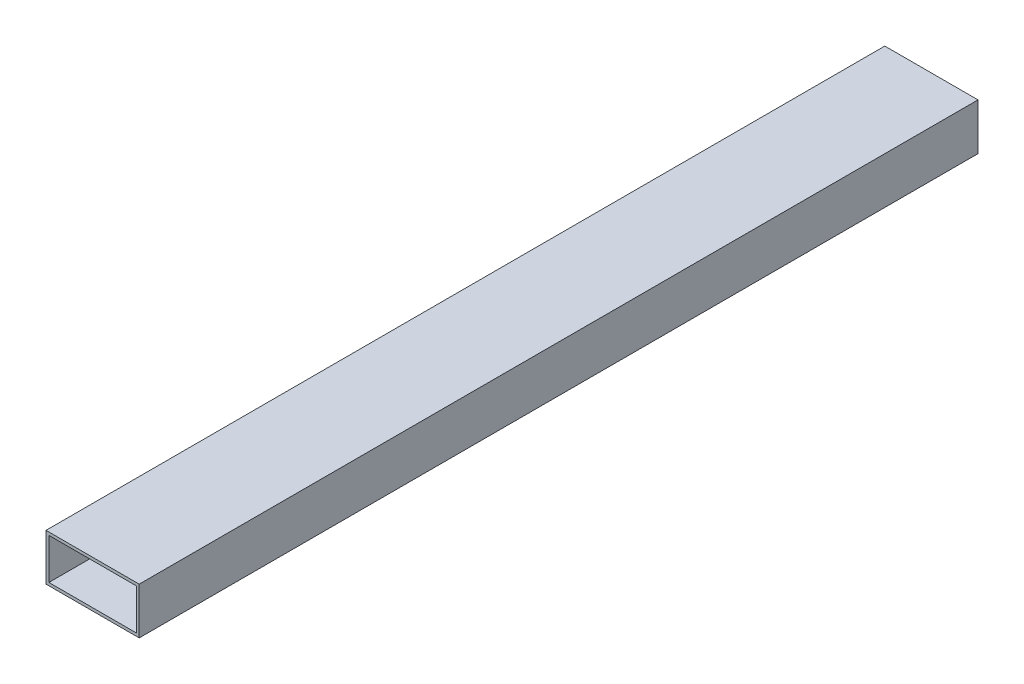
from build123d import *

# Parameters (mm, degrees)
SKETCH1_W           = 50.8
SKETCH1_H           = 25.4
SKETCH1_W_2         = 47.625
SKETCH1_H_2         = 22.225
BOSS_EXTRUDE1_DEPTH = 457.2


with BuildPart() as part:
    # Sketch1 → Boss-Extrude1 (new body)
    with BuildSketch(Plane.XY):
        with Locations((25.4, 12.7)):
            Rectangle(SKETCH1_W, SKETCH1_H)
        with Locations((25.4, 12.7)):
            Rectangle(SKETCH1_W_2, SKETCH1_H_2, mode=Mode.SUBTRACT)
    extrude(amount=BOSS_EXTRUDE1_DEPTH)


solid = part.part
